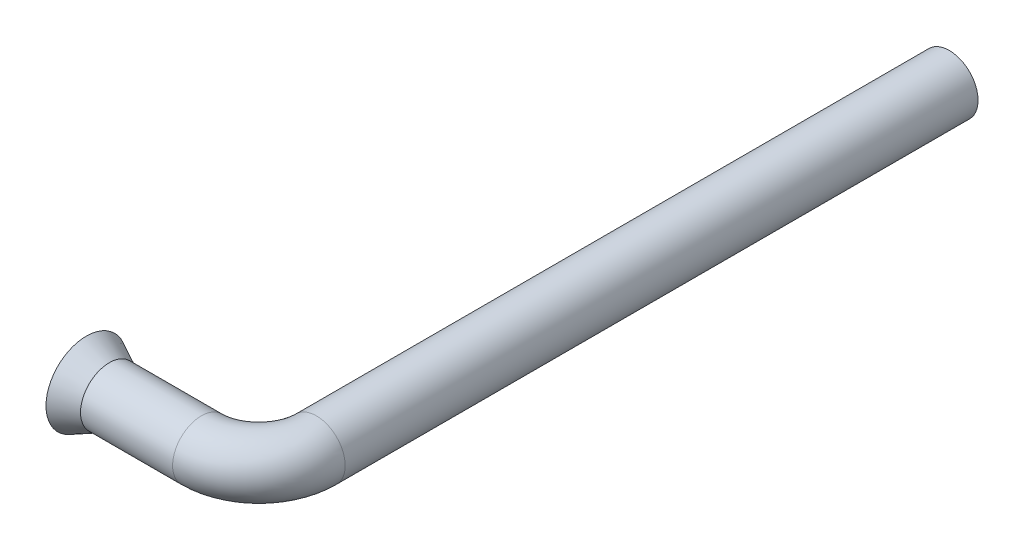
from build123d import *

# Parameters (mm, degrees)
SKETCH_2_R   = 5
SKETCH_2_R_2 = 4


with BuildPart() as part:
    # По траектории1: sweep along a path in Эскиз1
    with BuildLine(Plane(origin=(0, 0, 0), x_dir=(1, 0, 0), z_dir=(0, 1, 0))) as sweep_1_path:
        Line((0, 0), (20, 0))
        ThreePointArc((20, 0), (27.071067812, 2.928932188), (30, 10))
        Line((30, 10), (30, 120))
    # Эскиз2 → По траектории1 (sweep)
    with BuildSketch(Plane(origin=(0, 0, 0), x_dir=(0, 0, -1), z_dir=(1, 0, 0))):
        Circle(SKETCH_2_R)
        Circle(SKETCH_2_R_2, mode=Mode.SUBTRACT)
    sweep(path=sweep_1_path.line)

    # Эскиз3 → Повернуть1 (revolve)
    with BuildSketch(Plane.XY, mode=Mode.PRIVATE) as revolve_1_sk:
        Polygon((0, 7), (0, 4), (4, 4), (4, 5), align=None)
    revolve(revolve_1_sk.sketch.rotate(Axis((-3.453428096, 0, 0), (1, 0, 0)), 90), axis=Axis((-3.453428096, 0, 0), (1, 0, 0)))


solid = part.part
